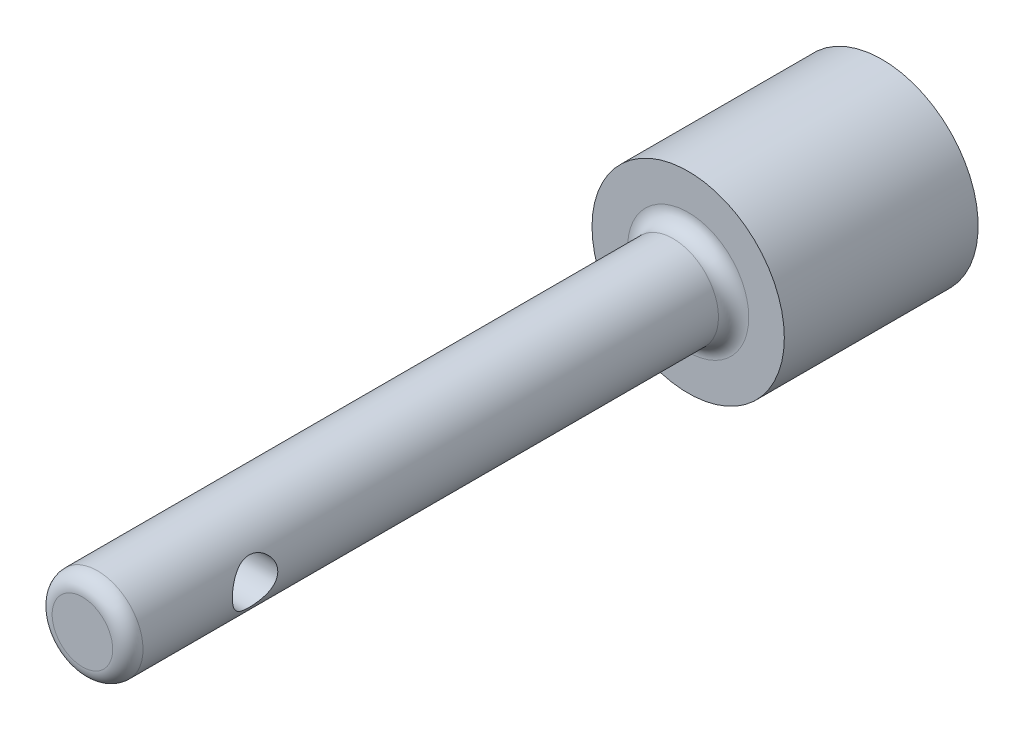
from build123d import *

# Parameters (mm, degrees)
SKETCH1_R               = 6.35
SKETCH1_R_2             = 3
BOSS_EXTRUDE1_DEPTH     = 11
SKETCH2_R               = 6.35
BOSS_EXTRUDE2_DEPTH     = 2
SKETCH3_R               = 3
BOSS_EXTRUDE3_DEPTH     = 40
CUT_EXTRUDE1_DEPTH      = 4
CUT_EXTRUDE1_DEPTH_BACK = 30
SKETCH4_R               = 1.25
FILLET1_R               = 1
FILLET2_R               = 1
CUT_EXTRUDE2_DEPTH      = 54.755418355
CUT_EXTRUDE2_DEPTH_BACK = 54.755418355
SKETCH5_R               = 1.5
SKETCH6_R               = 6.35
CUT_EXTRUDE3_DEPTH      = 0.2


with BuildPart() as part:
    # Sketch1 → Boss-Extrude1 (new body)
    with BuildSketch(Plane.XY):
        Circle(SKETCH1_R)
        Circle(SKETCH1_R_2, mode=Mode.SUBTRACT)
    extrude(amount=BOSS_EXTRUDE1_DEPTH)

    # Sketch2 → Boss-Extrude2 (add)
    with BuildSketch(Plane.XY.offset(11)):
        Circle(SKETCH2_R)
    extrude(amount=BOSS_EXTRUDE2_DEPTH)

    # Sketch3 → Boss-Extrude3 (add)
    with BuildSketch(Plane.XY.offset(13)):
        Circle(SKETCH3_R)
    extrude(amount=BOSS_EXTRUDE3_DEPTH)

    # Sketch4 → Cut-Extrude1 (cut, two sides: drawn at the far end of the back side and taken through both)
    with BuildSketch(Plane(origin=(0, 0, 0), x_dir=(0, 0, -1), z_dir=(1, 0, 0)).offset(-CUT_EXTRUDE1_DEPTH_BACK)):
        with Locations((-7, 0)):
            Circle(SKETCH4_R)
    extrude(amount=CUT_EXTRUDE1_DEPTH + CUT_EXTRUDE1_DEPTH_BACK, mode=Mode.SUBTRACT)

    # Fillet1
    fillet1_edges = [part.edges().sort_by_distance(p)[0] for p in [
        (-3, 0, 13),
    ]]
    fillet(fillet1_edges, radius=FILLET1_R)

    # Fillet2
    fillet2_edges = [part.edges().sort_by_distance(p)[0] for p in [
        (-3, 0, 53),
    ]]
    fillet(fillet2_edges, radius=FILLET2_R)

    # Sketch5 → Cut-Extrude2 (cut, two sides: drawn at the far end of the back side and taken through both)
    with BuildSketch(Plane(origin=(0, 0, 0), x_dir=(0, 0, -1), z_dir=(1, 0, 0)).offset(-CUT_EXTRUDE2_DEPTH_BACK)):
        with Locations(Location((-44.6, 0, 0), (0, 0, 179.999999999))):
            Circle(SKETCH5_R)
    extrude(amount=CUT_EXTRUDE2_DEPTH + CUT_EXTRUDE2_DEPTH_BACK, mode=Mode.SUBTRACT)

    # Sketch6 → Cut-Extrude3 (cut)
    with BuildSketch(Plane(origin=(0, 0, 0), x_dir=(-1, 0, 0), z_dir=(0, 0, -1))):
        Circle(SKETCH6_R)
    extrude(amount=-CUT_EXTRUDE3_DEPTH, mode=Mode.SUBTRACT)


solid = part.part
